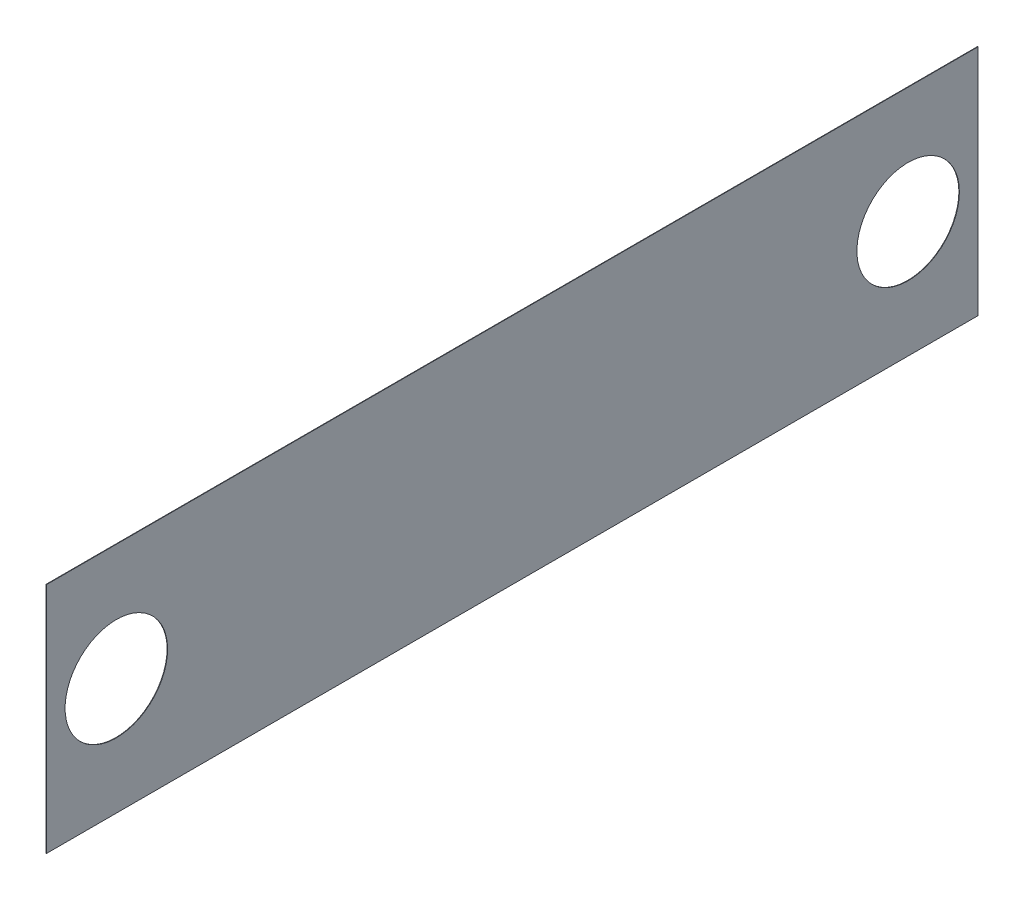
from build123d import *

# Parameters (mm, degrees)
SKETCH1_W             = 100
SKETCH1_H             = 25
BOSS_EXTRUDE1_DEPTH   = 0.0508
M10_CLEARANCE_HOLE1_D = 11


with BuildPart() as part:
    # Sketch1 → Boss-Extrude1 (new body)
    with BuildSketch(Plane(origin=(0, 0, 0), x_dir=(0, 0, -1), z_dir=(1, 0, 0))):
        Rectangle(SKETCH1_W, SKETCH1_H)
    extrude(amount=BOSS_EXTRUDE1_DEPTH)

    # M10 Clearance Hole1 (through all)
    with Locations(Plane(origin=(0.0508, 0, 0), x_dir=(0, 0, -1), z_dir=(1, 0, 0))):
        with Locations((-42.5, 0), (42.5, 0)):
            Hole(M10_CLEARANCE_HOLE1_D / 2)


solid = part.part
